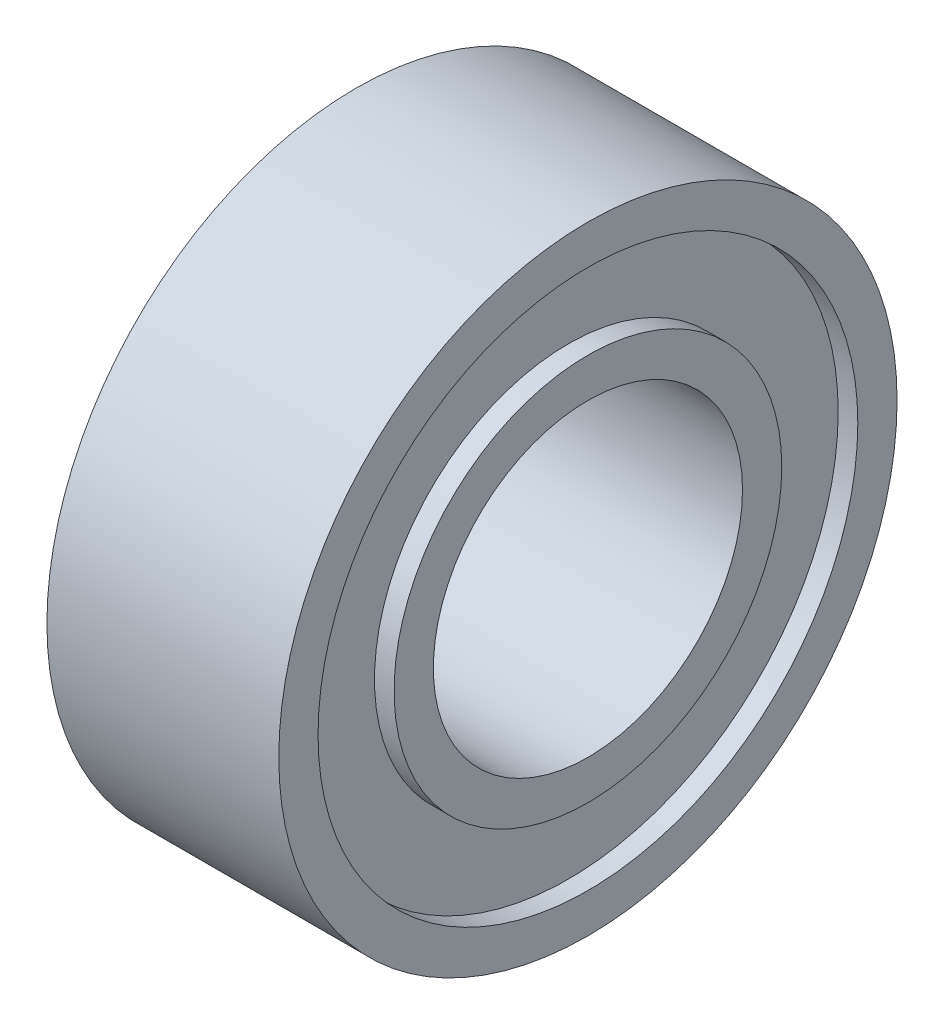
from build123d import *

# Parameters (mm, degrees)
SKETCH1_R           = 4
SKETCH1_R_2         = 2
BOSS_EXTRUDE1_DEPTH = 1.5
SKETCH2_R           = 3.492
SKETCH2_R_2         = 2.508
CUT_EXTRUDE1_DEPTH  = 0.254


with BuildPart() as part:
    # Sketch1 → Boss-Extrude1 (new, symmetric)
    with BuildSketch(Plane(origin=(0, 0, 0), x_dir=(0, 0, -1), z_dir=(1, 0, 0))):
        Circle(SKETCH1_R)
        Circle(SKETCH1_R_2, mode=Mode.SUBTRACT)
    extrude(amount=BOSS_EXTRUDE1_DEPTH, both=True)

    # Sketch2 → Cut-Extrude1 (cut)
    with BuildSketch(Plane(origin=(1.5, 0, 0), x_dir=(0, 0, -1), z_dir=(1, 0, 0))):
        Circle(SKETCH2_R)
        Circle(SKETCH2_R_2, mode=Mode.SUBTRACT)
    cut_extrude1 = extrude(amount=-CUT_EXTRUDE1_DEPTH, mode=Mode.SUBTRACT)

    # Mirror1: Cut-Extrude1 across plane
    add(cut_extrude1.mirror(Plane(origin=(0, 0, 0), x_dir=(0, 0, 1), z_dir=(1, 0, 0))), mode=Mode.SUBTRACT)


solid = part.part
